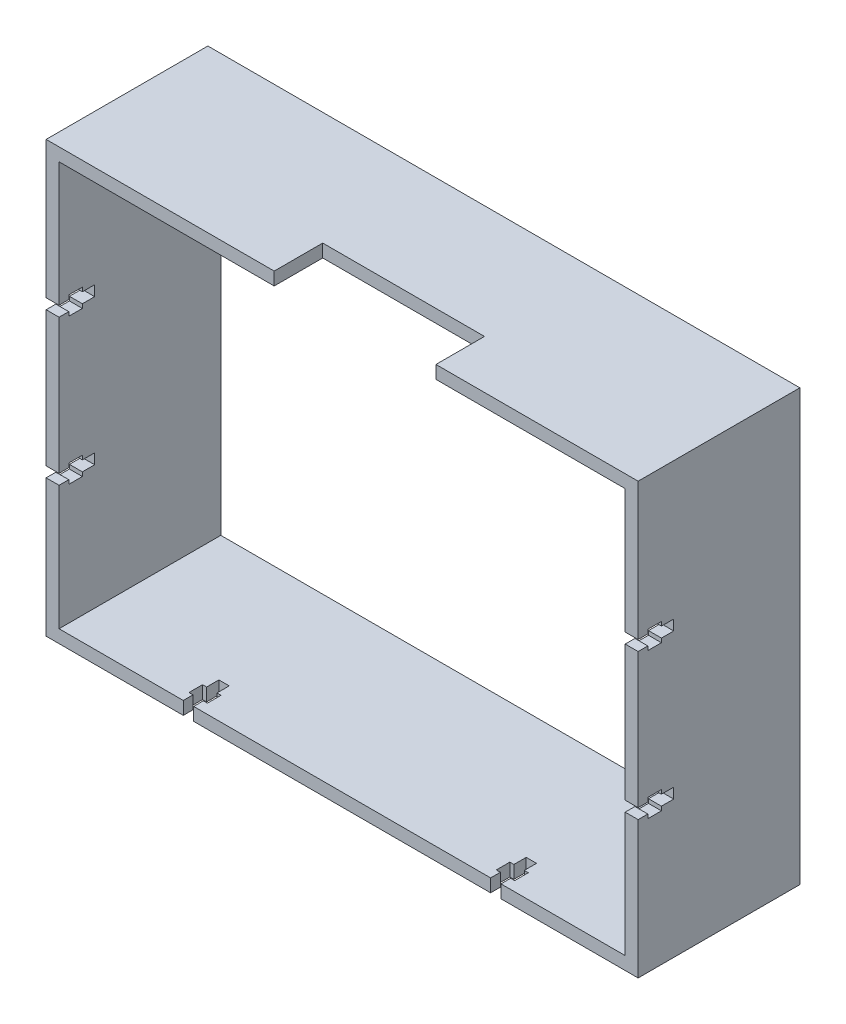
from build123d import *

# Parameters (mm, degrees)
ESQUISSE2_W             = 183
ESQUISSE2_H             = 133
BOSS_EXTRU_2_DEPTH      = 50
ESQUISSE3_W             = 50
ESQUISSE3_H             = 15
ENL_V_MAT_EXTRU_1_DEPTH = 50
ENL_V_MAT_EXTRU_3_DEPTH = 4
ENL_V_MAT_EXTRU_4_DEPTH = 4
ENL_V_MAT_EXTRU_5_DEPTH = 4


with BuildPart() as part:
    # Esquisse2 → Boss.-Extru.2 (new body)
    with BuildSketch(Plane.XY):
        Rectangle(ESQUISSE2_W, ESQUISSE2_H)
        Polygon((-85.996240602, -62.5), (-87.5, -62.5), (-87.5, 62.5), (87.5, 62.5), (87.5, -62.5), align=None, mode=Mode.SUBTRACT)
    extrude(amount=BOSS_EXTRU_2_DEPTH)

    # Esquisse3 → Enlèv. mat.-Extru.1 (cut)
    with BuildSketch(Plane(origin=(0, 66.5, 0), x_dir=(1, 0, 0), z_dir=(0, 1, 0))):
        with Locations((4, -42.5)):
            Rectangle(ESQUISSE3_W, ESQUISSE3_H)
    extrude(amount=-ENL_V_MAT_EXTRU_1_DEPTH, mode=Mode.SUBTRACT)

    # Esquisse6 → Enlèv. mat.-Extru.3 (cut)
    with BuildSketch(Plane(origin=(91.5, 0, 0), x_dir=(0, 0, -1), z_dir=(1, 0, 0))):
        Polygon((-50, 20.9), (-47, 20.9), (-47, 19.65), (-42.8, 19.65), (-42.8, 20.9), (-39, 20.9), (-39, 24.1), (-42.8, 24.1), (-42.8, 25.35), (-47, 25.35), (-47, 24.1), (-50, 24.1), align=None)
        Polygon((-50, -24.1), (-47, -24.1), (-47, -25.35), (-42.8, -25.35), (-42.8, -24.1), (-39, -24.1), (-39, -20.9), (-42.8, -20.9), (-42.8, -19.65), (-47, -19.65), (-47, -20.9), (-50, -20.9), align=None)
    extrude(amount=-ENL_V_MAT_EXTRU_3_DEPTH, mode=Mode.SUBTRACT)

    # Esquisse7 → Enlèv. mat.-Extru.4 (cut)
    with BuildSketch(Plane.ZY.offset(91.5)):
        Polygon((47, 20.9), (50, 20.9), (50, 24.1), (47, 24.1), (47, 25.35), (42.8, 25.35), (42.8, 24.1), (39, 24.1), (39, 20.9), (42.8, 20.9), (42.8, 19.65), (47, 19.65), align=None)
        Polygon((47, -24.1), (50, -24.1), (50, -20.9), (47, -20.9), (47, -19.65), (42.8, -19.65), (42.8, -20.9), (39, -20.9), (39, -24.1), (42.8, -24.1), (42.8, -25.35), (47, -25.35), align=None)
    extrude(amount=-ENL_V_MAT_EXTRU_4_DEPTH, mode=Mode.SUBTRACT)

    # Esquisse9 → Enlèv. mat.-Extru.5 (cut)
    with BuildSketch(Plane.XZ.offset(66.5)):
        Polygon((-49.1, 50), (-45.9, 50), (-45.9, 47), (-44.65, 47), (-44.65, 42.8), (-45.9, 42.8), (-45.9, 39), (-49.1, 39), (-49.1, 42.8), (-50.35, 42.8), (-50.35, 47), (-49.1, 47), align=None)
        Polygon((45.9, 50), (45.9, 47), (44.65, 47), (44.65, 42.8), (45.9, 42.8), (45.9, 39), (49.1, 39), (49.1, 42.8), (50.35, 42.8), (50.35, 47), (49.1, 47), (49.1, 50), align=None)
    extrude(amount=-ENL_V_MAT_EXTRU_5_DEPTH, mode=Mode.SUBTRACT)


solid = part.part
